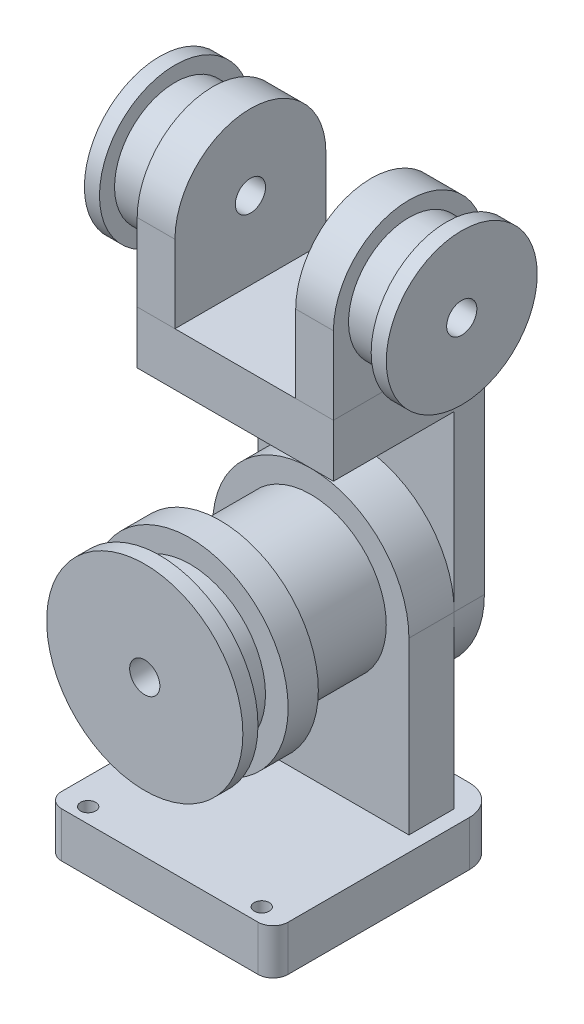
from build123d import *

# Parameters (mm, degrees)
SKETCH4_R            = 5
SKETCH4_R_2          = 1
BOSS_EXTRUDE5_DEPTH  = 15
BOSS_EXTRUDE7_START  = -4
SKETCH5_R            = 6.5
SKETCH5_R_2          = 1
BOSS_EXTRUDE7_DEPTH  = 2
SKETCH7_R            = 6.5
SKETCH7_R_2          = 1
BOSS_EXTRUDE8_DEPTH  = 1
SKETCH8_R            = 1
BOSS_EXTRUDE9_DEPTH  = 2
BOSS_EXTRUDE10_DEPTH = 10
SKETCH10_R           = 1
BOSS_EXTRUDE11_DEPTH = 2.5
SKETCH11_R           = 4
SKETCH11_R_2         = 1
BOSS_EXTRUDE12_DEPTH = 2.5
SKETCH12_R           = 5
SKETCH12_R_2         = 1
BOSS_EXTRUDE13_DEPTH = 1
SKETCH13_R           = 5
BOSS_EXTRUDE14_DEPTH = 3
SKETCH14_R           = 0.5
BOSS_EXTRUDE15_DEPTH = 3


with BuildPart() as part:
    # Sketch4 → Boss-Extrude5 (new body)
    with BuildSketch(Plane.XY):
        Circle(SKETCH4_R)
        Circle(SKETCH4_R_2, mode=Mode.SUBTRACT)
    extrude(amount=BOSS_EXTRUDE5_DEPTH)

    # Sketch5 → Boss-Extrude7 (add)
    with BuildSketch(Plane.XY.offset(15).offset(BOSS_EXTRUDE7_START)):
        Circle(SKETCH5_R)
        Circle(SKETCH5_R_2, mode=Mode.SUBTRACT)
    extrude(amount=BOSS_EXTRUDE7_DEPTH)

    # Sketch7 → Boss-Extrude8 (add)
    with BuildSketch(Plane.XY.offset(15)):
        Circle(SKETCH7_R)
        Circle(SKETCH7_R_2, mode=Mode.SUBTRACT)
    extrude(amount=BOSS_EXTRUDE8_DEPTH)

    # Sketch8 → Boss-Extrude9 (add)
    with BuildSketch(Plane(origin=(0, 0, 0), x_dir=(-1, 0, 0), z_dir=(0, 0, -1))):
        with BuildLine():
            Line((6.5, 0), (6.5, 13))
            Line((6.5, 13), (-6.5, 13))
            Line((-6.5, 13), (-6.5, 0))
            ThreePointArc((-6.5, 0), (0, -6.5), (6.5, 0))
        make_face()
        with Locations(Location((0, 0, 0), (0, 0, 180))):
            Circle(SKETCH8_R, mode=Mode.SUBTRACT)
    extrude(amount=-BOSS_EXTRUDE9_DEPTH)

    # Sketch9 → Boss-Extrude10 (add)
    with BuildSketch(Plane(origin=(0, 0, 0), x_dir=(-1, 0, 0), z_dir=(0, 0, -1))):
        Polygon((-6.5, 13), (-6.5, 15), (6.5, 15), (6.5, 13), (6.5, 11.5), (-6.5, 11.5), align=None)
    extrude(amount=-BOSS_EXTRUDE10_DEPTH)

    # Sketch13 → Boss-Extrude14 (add)
    with BuildSketch(Plane.XY.offset(2)):
        with BuildLine():
            Line((6.5, 0), (6.5, -11.293549967))
            Line((6.5, -11.293549967), (-6.5, -11.293549967))
            Line((-6.5, -11.293549967), (-6.5, 0))
            ThreePointArc((-6.5, 0), (0, 6.5), (6.5, 0))
        make_face()
        Circle(SKETCH13_R, mode=Mode.SUBTRACT)
    extrude(amount=BOSS_EXTRUDE14_DEPTH)

    # Sketch14 → Boss-Extrude15 (add)
    with BuildSketch(Plane.XZ.offset(11.293549967)):
        with BuildLine():
            Line((6.5, 15), (-6.5, 15))
            ThreePointArc((-6.5, 15), (-7.207106781, 14.707106781), (-7.5, 14))
            Line((-7.5, 14), (-7.5, 2))
            ThreePointArc((-7.5, 2), (-6.914213562, 0.585786438), (-5.5, 0))
            Line((-5.5, 0), (5.5, 0))
            ThreePointArc((5.5, 0), (6.914213562, 0.585786438), (7.5, 2))
            Line((7.5, 2), (7.5, 14))
            ThreePointArc((7.5, 14), (7.207106781, 14.707106781), (6.5, 15))
        make_face()
        with Locations(Location((5.75, 14, 0), (0, 0, 270))):
            Circle(SKETCH14_R, mode=Mode.SUBTRACT)
        with Locations(Location((-5.75, 14, 0), (0, 0, 270))):
            Circle(SKETCH14_R, mode=Mode.SUBTRACT)
    extrude(amount=BOSS_EXTRUDE15_DEPTH)


with BuildPart() as body_2:
    # Sketch10 → Boss-Extrude11 (new body)
    with BuildSketch(Plane(origin=(6.5, 0, 0), x_dir=(0, 0, -1), z_dir=(1, 0, 0))):
        with BuildLine():
            Line((-10, 20.132551776), (-10, 15))
            Line((-10, 15), (0, 15))
            Line((0, 15), (0, 20.132551776))
            ThreePointArc((0, 20.132551776), (-5, 25.132551776), (-10, 20.132551776))
        make_face()
        with Locations(Location((-5, 20.132551776, 0), (0, 0, 90))):
            Circle(SKETCH10_R, mode=Mode.SUBTRACT)
    extrude(amount=-BOSS_EXTRUDE11_DEPTH)

    # Sketch11 → Boss-Extrude12 (add)
    with BuildSketch(Plane(origin=(6.5, 0, 0), x_dir=(0, 0, -1), z_dir=(1, 0, 0))):
        with Locations(Location((-5, 20.132551776, 0), (0, 0, 90))):
            Circle(SKETCH11_R)
        with Locations(Location((-5, 20.132551776, 0), (0, 0, 90))):
            Circle(SKETCH11_R_2, mode=Mode.SUBTRACT)
    extrude(amount=BOSS_EXTRUDE12_DEPTH)

    # Sketch12 → Boss-Extrude13 (add)
    with BuildSketch(Plane(origin=(9, 0, 0), x_dir=(0, 0, -1), z_dir=(1, 0, 0))):
        with Locations(Location((-5, 20.132551776, 0), (0, 0, 90))):
            Circle(SKETCH12_R)
        with Locations(Location((-5, 20.132551776, 0), (0, 0, 90))):
            Circle(SKETCH12_R_2, mode=Mode.SUBTRACT)
    extrude(amount=BOSS_EXTRUDE13_DEPTH)


with BuildPart() as body_3:
    # Mirror4: mirrored copy
    add(body_2.part.mirror(Plane(origin=(0, 0, 0), x_dir=(0, 0, 1), z_dir=(1, 0, 0))))


solid = Compound([part.part, body_2.part, body_3.part])
